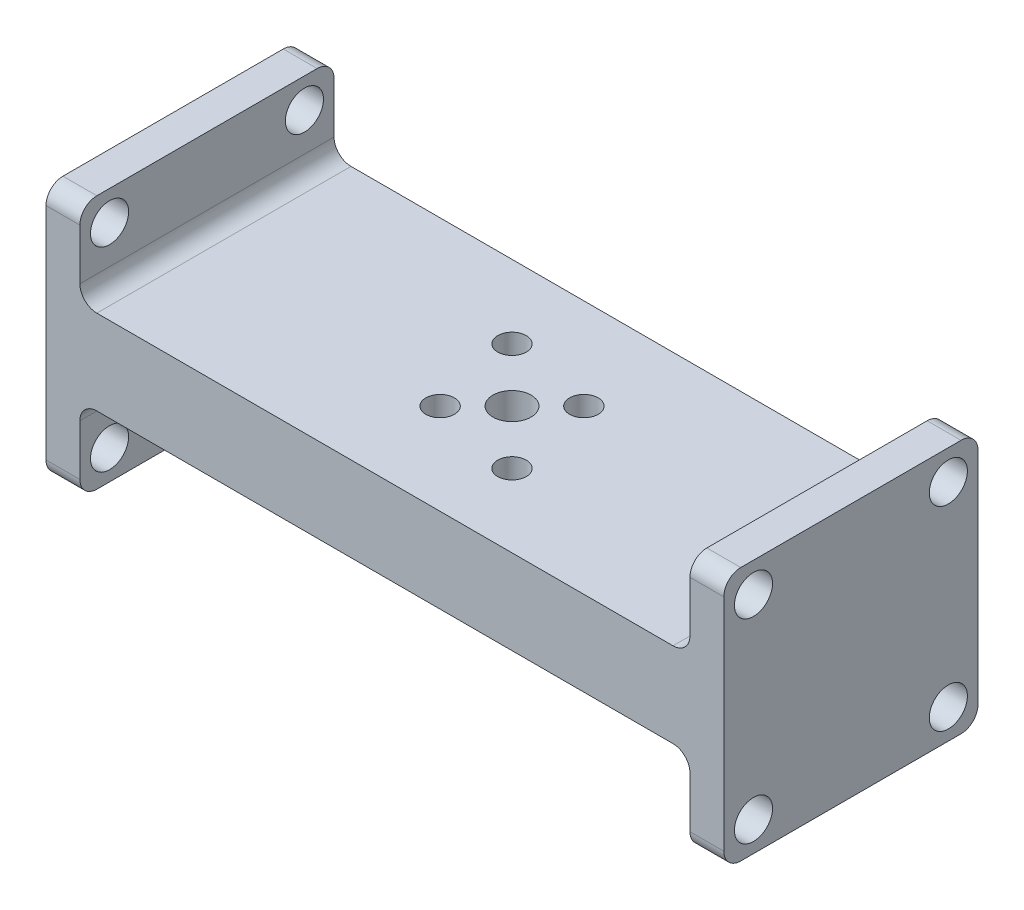
from build123d import *

# Parameters (mm, degrees)
SKETCH2_W           = 72
SKETCH2_H           = 30
SKETCH2_R           = 2.25
SKETCH2_R_2         = 1.6875
BOSS_EXTRUDE1_DEPTH = 10
SKETCH3_W           = 30
SKETCH3_H           = 30
SKETCH3_R           = 2.25
BOSS_EXTRUDE2_DEPTH = 4
FILLET1_R           = 2
FILLET2_R           = 2


with BuildPart() as part:
    # Sketch2 → Boss-Extrude1 (new body)
    with BuildSketch(Plane(origin=(0, 0, 0), x_dir=(1, 0, 0), z_dir=(0, 1, 0))):
        Rectangle(SKETCH2_W, SKETCH2_H)
        with Locations(Location((0, 0, 0), (0, 0, 270))):
            Circle(SKETCH2_R, mode=Mode.SUBTRACT)
        with Locations(Location((-6.363961031, 6.363961031, 0), (0, 0, 270))):
            Circle(SKETCH2_R_2, mode=Mode.SUBTRACT)
        with Locations(Location((6.363961031, -6.363961031, 0), (0, 0, 270))):
            Circle(SKETCH2_R_2, mode=Mode.SUBTRACT)
        with Locations(Location((4.242640687, 4.242640687, 0), (0, 0, 270))):
            Circle(SKETCH2_R_2, mode=Mode.SUBTRACT)
        with Locations(Location((-4.242640687, -4.242640687, 0), (0, 0, 270))):
            Circle(SKETCH2_R_2, mode=Mode.SUBTRACT)
    extrude(amount=BOSS_EXTRUDE1_DEPTH)

    # Sketch3 → Boss-Extrude2 (add)
    with BuildSketch(Plane.ZY.offset(36)):
        with Locations((0, 5)):
            Rectangle(SKETCH3_W, SKETCH3_H)
        with Locations((-11.5, 16.5)):
            Circle(SKETCH3_R, mode=Mode.SUBTRACT)
        with Locations((-11.5, -6.5)):
            Circle(SKETCH3_R, mode=Mode.SUBTRACT)
        with Locations((11.5, -6.5)):
            Circle(SKETCH3_R, mode=Mode.SUBTRACT)
        with Locations((11.5, 16.5)):
            Circle(SKETCH3_R, mode=Mode.SUBTRACT)
    boss_extrude2 = extrude(amount=BOSS_EXTRUDE2_DEPTH)

    # Mirror1: Boss-Extrude2 across plane
    add(boss_extrude2.mirror(Plane(origin=(0, 0, 0), x_dir=(0, 0, 1), z_dir=(1, 0, 0))))

    # Fillet1
    fillet1_edges = [part.edges().sort_by_distance(p)[0] for p in [
        (-36, 10, 0),
        (-36, 0, 0),
        (36, 0, 0),
        (36, 10, 0),
    ]]
    fillet(fillet1_edges, radius=FILLET1_R)

    # Fillet2
    fillet2_edges = [part.edges().sort_by_distance(p)[0] for p in [
        (-38, 20, 15),
        (-38, 20, -15),
        (-38, -10, -15),
        (-38, -10, 15),
        (38, 20, -15),
        (38, 20, 15),
        (38, -10, 15),
        (38, -10, -15),
    ]]
    fillet(fillet2_edges, radius=FILLET2_R)


solid = part.part
